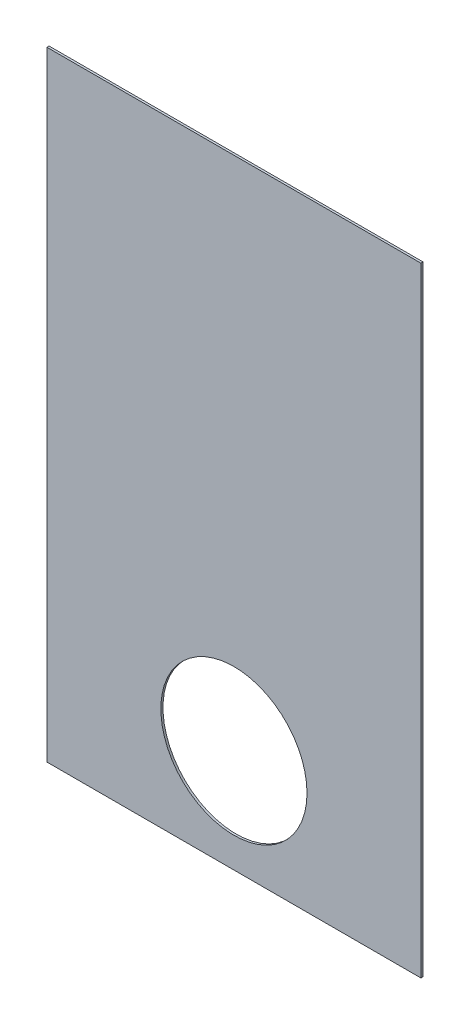
from build123d import *

# Parameters (mm, degrees)
SKETCH1_W           = 552.45
SKETCH1_H           = 914.4
BOSS_EXTRUDE1_DEPTH = 3.175
SKETCH2_R           = 107.95
CUT_EXTRUDE1_DEPTH  = 5.08


with BuildPart() as part:
    # Sketch1 → Boss-Extrude1 (new body)
    with BuildSketch(Plane.XY):
        Rectangle(SKETCH1_W, SKETCH1_H)
    extrude(amount=BOSS_EXTRUDE1_DEPTH)

    # Sketch2 → Cut-Extrude1 (cut)
    with BuildSketch(Plane.XY.offset(3.175)):
        with Locations((0, -304.8)):
            Circle(SKETCH2_R)
    extrude(amount=-CUT_EXTRUDE1_DEPTH, mode=Mode.SUBTRACT)


solid = part.part
